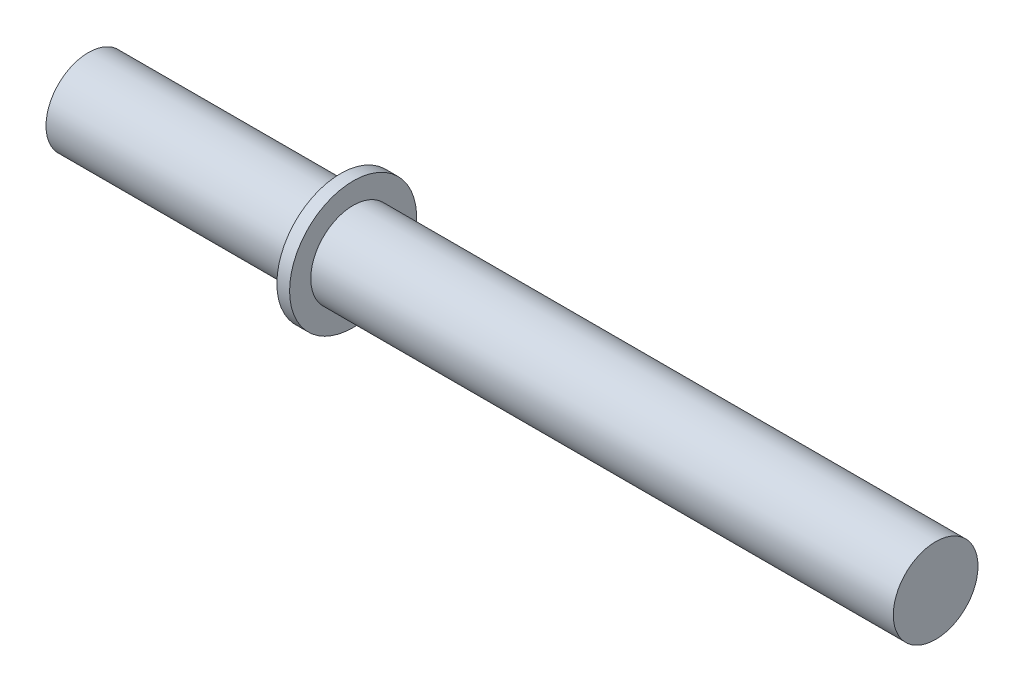
from build123d import *

# Parameters (mm, degrees)
CROQUIS1_R              = 10
SALIENTE_EXTRUIR1_DEPTH = 200
CROQUIS2_R              = 15
SALIENTE_EXTRUIR2_DEPTH = 3


with BuildPart() as part:
    # Croquis1 → Saliente-Extruir1 (new body)
    with BuildSketch(Plane(origin=(0, 0, 0), x_dir=(0, 0, -1), z_dir=(1, 0, 0))):
        Circle(CROQUIS1_R)
    extrude(amount=SALIENTE_EXTRUIR1_DEPTH)

    # Croquis2 → Saliente-Extruir2 (add)
    with BuildSketch(Plane.ZY.offset(-62.5)):
        Circle(CROQUIS2_R)
    extrude(amount=SALIENTE_EXTRUIR2_DEPTH)


solid = part.part
